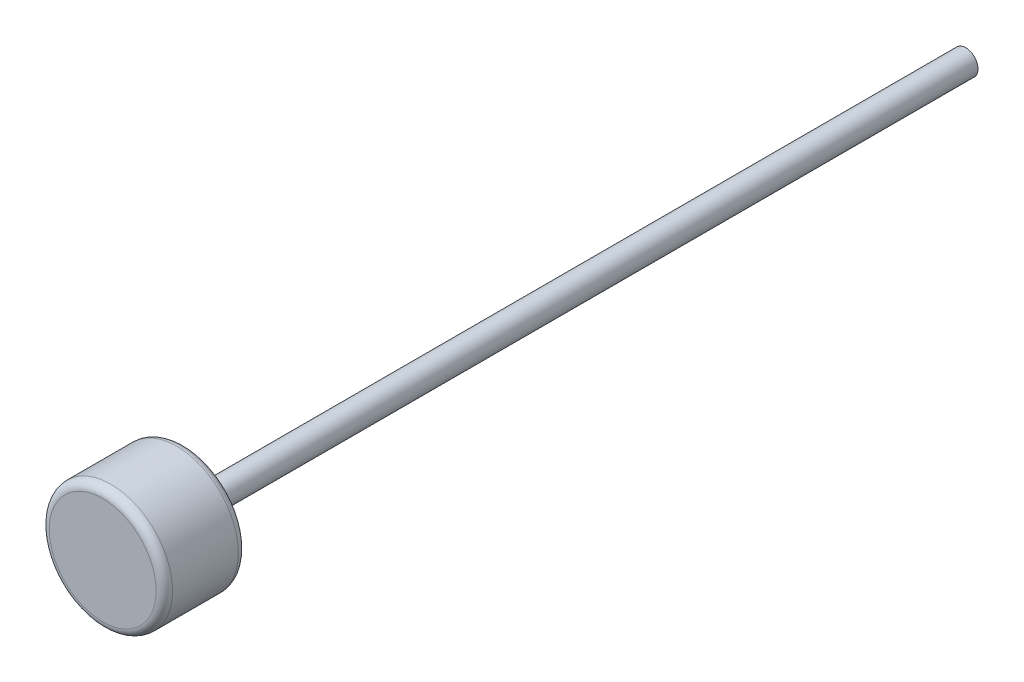
from build123d import *

# Parameters (mm, degrees)
SKETCH1_R           = 1.5
BOSS_EXTRUDE1_DEPTH = 95
SKETCH2_R           = 7.5
BOSS_EXTRUDE2_DEPTH = 10
FILLET1_R           = 1
FILLET2_R           = 1


with BuildPart() as part:
    # Sketch1 → Boss-Extrude1 (new body)
    with BuildSketch(Plane.XY):
        Circle(SKETCH1_R)
    extrude(amount=BOSS_EXTRUDE1_DEPTH)

    # Sketch2 → Boss-Extrude2 (add)
    with BuildSketch(Plane.XY.offset(95)):
        Circle(SKETCH2_R)
    extrude(amount=BOSS_EXTRUDE2_DEPTH)

    # Fillet1
    fillet1_edges = [part.edges().sort_by_distance(p)[0] for p in [
        (-7.5, 0, 105),
    ]]
    fillet(fillet1_edges, radius=FILLET1_R)

    # Fillet2
    fillet2_edges = [part.edges().sort_by_distance(p)[0] for p in [
        (-7.5, 0, 95),
    ]]
    fillet(fillet2_edges, radius=FILLET2_R)


solid = part.part
